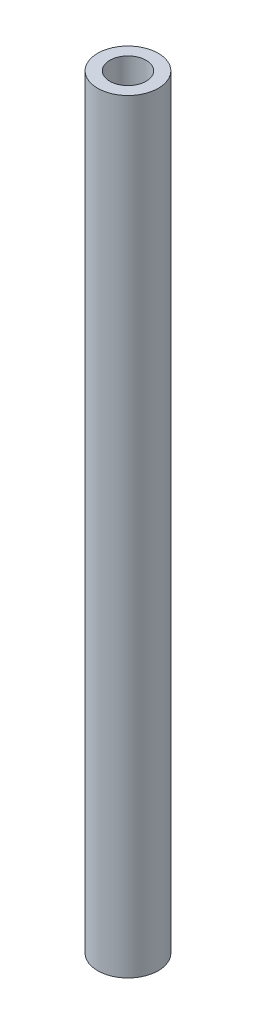
from build123d import *

# Parameters (mm, degrees)
SKETCH_1_R      = 2.5
SKETCH_1_R_2    = 1.5
EXTRUDE_1_DEPTH = 63


with BuildPart() as part:
    # 草图1 → 凸台-拉伸1 (new body)
    with BuildSketch(Plane(origin=(0, 0, 0), x_dir=(1, 0, 0), z_dir=(0, 1, 0))):
        with Locations(Location((0, 0, 0), (0, 0, 270))):
            Circle(SKETCH_1_R)
        with Locations(Location((0, 0, 0), (0, 0, 270))):
            Circle(SKETCH_1_R_2, mode=Mode.SUBTRACT)
    extrude(amount=EXTRUDE_1_DEPTH)


solid = part.part
